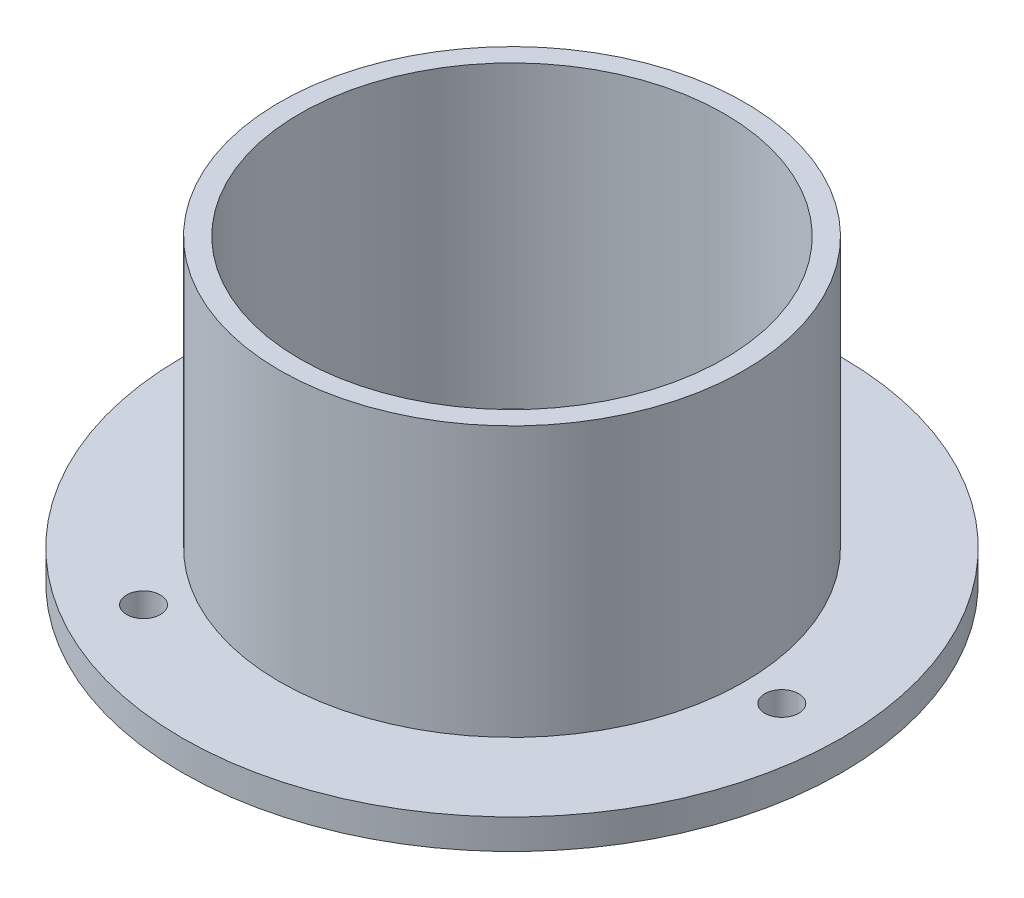
from build123d import *

# Parameters (mm, degrees)
SKETCH1_R           = 23.25
SKETCH1_R_2         = 21.25
BOSS_EXTRUDE1_DEPTH = 30
SKETCH1_4_R         = 33
SKETCH1_4_R_2       = 23.25
BOSS_EXTRUDE2_DEPTH = 3
SKETCH2_R           = 1.7
CUT_EXTRUDE1_DEPTH  = 54.916602267


with BuildPart() as part:
    # Sketch1 → Boss-Extrude1 (new body)
    with BuildSketch(Plane(origin=(0, 0, 0), x_dir=(1, 0, 0), z_dir=(0, 1, 0))):
        Circle(SKETCH1_R)
        Circle(SKETCH1_R_2, mode=Mode.SUBTRACT)
    extrude(amount=BOSS_EXTRUDE1_DEPTH)

    # Sketch1<4> → Boss-Extrude2 (add)
    with BuildSketch(Plane(origin=(0, 0, 0), x_dir=(1, 0, 0), z_dir=(0, 1, 0))):
        Circle(SKETCH1_4_R)
        Circle(SKETCH1_4_R_2, mode=Mode.SUBTRACT)
    extrude(amount=BOSS_EXTRUDE2_DEPTH)

    # Sketch2 → Cut-Extrude1 (cut, through all)
    with BuildSketch(Plane(origin=(0, 3, 0), x_dir=(1, 0, 0), z_dir=(0, 1, 0))):
        with Locations((27, 0)):
            Circle(SKETCH2_R)
        with Locations((-13.5, -23.382685902)):
            Circle(SKETCH2_R)
        with Locations((-13.5, 23.382685902)):
            Circle(SKETCH2_R)
    extrude(amount=-CUT_EXTRUDE1_DEPTH, mode=Mode.SUBTRACT)


solid = part.part
